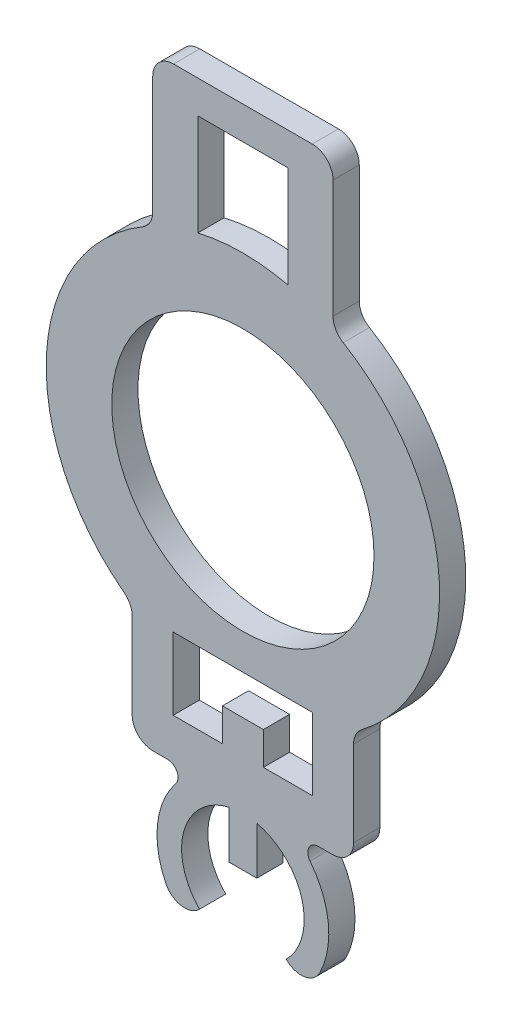
from build123d import *

# Parameters (mm, degrees)
SKETCH2_R           = 8
BOSS_EXTRUDE1_DEPTH = 1.6
FILLET1_R           = 0.635
FILLET2_R           = 1.27


with BuildPart() as part:
    # Sketch2 → Boss-Extrude1 (new body)
    with BuildSketch(Plane.XY):
        with BuildLine():
            Line((-5.5, 32.016485365), (-5.5, 41.221120861))
            Line((-5.5, 41.221120861), (5.5, 41.221120861))
            Line((5.5, 41.221120861), (5.5, 32.016485365))
            ThreePointArc((5.5, 32.016485365), (11.977775563, 22.081115767), (6.7545, 11.43261645))
            Line((6.7545, 11.43261645), (6.7545, 4.296230906))
            Line((6.7545, 4.296230906), (3, 4.296230906))
            ThreePointArc((3, 4.296230906), (5.219764516, 0.460063475), (3.705239533, -3.705239533))
            Line((3.705239533, -3.705239533), (2.644579362, -2.644579362))
            ThreePointArc((2.644579362, -2.644579362), (3.596344694, 1.026598676), (0.85, 3.642128499))
            Line((0.85, 3.642128499), (0.85, 0.74))
            Line((0.85, 0.74), (-0.85, 0.74))
            Line((-0.85, 0.74), (-0.85, 3.642128499))
            ThreePointArc((-0.85, 3.642128499), (-3.596344694, 1.026598676), (-2.644579362, -2.644579362))
            Line((-2.644579362, -2.644579362), (-3.705239533, -3.705239533))
            ThreePointArc((-3.705239533, -3.705239533), (-5.219764516, 0.460063475), (-3, 4.296230906))
            Line((-3, 4.296230906), (-6.7545, 4.296230906))
            Line((-6.7545, 4.296230906), (-6.7545, 11.43261645))
            ThreePointArc((-6.7545, 11.43261645), (-11.977775563, 22.081115767), (-5.5, 32.016485365))
        make_face()
        with Locations((0, 21.351120861)):
            Circle(SKETCH2_R, mode=Mode.SUBTRACT)
        with BuildLine():
            Line((-2.75, 39.221120861), (2.75, 39.221120861))
            Line((2.75, 39.221120861), (2.75, 33.031767248))
            ThreePointArc((2.75, 33.031767248), (0, 33.351120861), (-2.75, 33.031767248))
            Line((-2.75, 33.031767248), (-2.75, 39.221120861))
        make_face(mode=Mode.SUBTRACT)
        Polygon((-1.25, 6.796230906), (-1.25, 8.796230906), (1.25, 8.796230906), (1.25, 6.796230906), (4.2545, 6.796230906), (4.2545, 11.196230906), (-4.2545, 11.196230906), (-4.2545, 6.796230906), align=None, mode=Mode.SUBTRACT)
    extrude(amount=BOSS_EXTRUDE1_DEPTH)

    # Fillet1
    fillet1_edges = [part.edges().sort_by_distance(p)[0] for p in [
        (-3, 4.296230906, 0.8),
        (3, 4.296230906, 0.8),
    ]]
    fillet(fillet1_edges, radius=FILLET1_R)

    # Fillet2
    fillet2_edges = [part.edges().sort_by_distance(p)[0] for p in [
        (-6.7545, 4.296230906, 0.8),
        (-6.7545, 11.43261645, 0.8),
        (-5.5, 32.016485365, 0.8),
        (-5.5, 41.221120861, 0.8),
        (5.5, 41.221120861, 0.8),
        (5.5, 32.016485365, 0.8),
        (6.7545, 11.43261645, 0.8),
        (6.7545, 4.296230906, 0.8),
        (3.705239533, -3.705239533, 0.8),
        (-3.705239533, -3.705239533, 0.8),
    ]]
    fillet(fillet2_edges, radius=FILLET2_R)


solid = part.part
